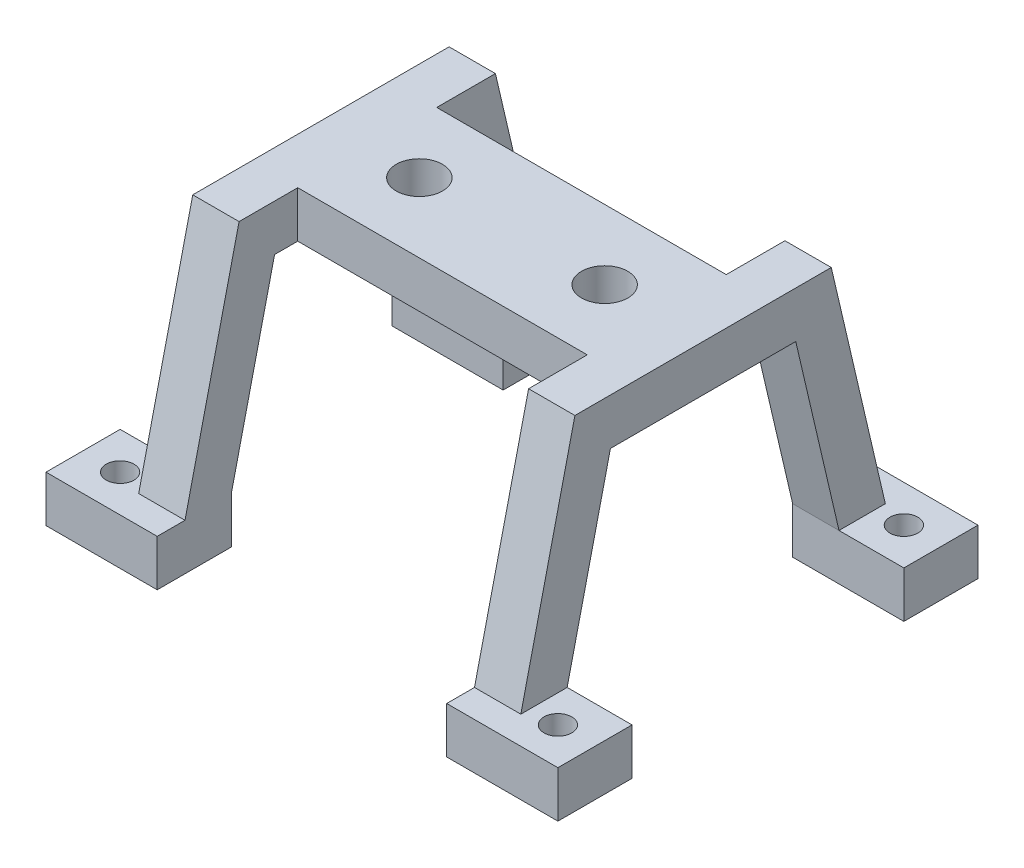
from build123d import *

# Parameters (mm, degrees)
SKETCH_1_W               = 12
SKETCH_1_H               = 8
SKETCH_1_R               = 1.5
EXTRUDE_1_DEPTH          = 5
EXTRUDE_2_DEPTH          = 5
SKETCH_3_W               = 15.622
SKETCH_3_H               = 15
SKETCH_3_R               = 2.5
EXTRUDE_3_DEPTH          = 5
MIRROR_5_COPY_1_SKETCH_W = 12
MIRROR_5_COPY_1_SKETCH_H = 8
MIRROR_5_COPY_1_SKETCH_R = 1.5
MIRROR_5_COPY_1_DEPTH    = 5
MIRROR_5_COPY_2_DEPTH    = 5


with BuildPart() as part:
    # 草图1 → 凸台-拉伸1 (new body)
    with BuildSketch(Plane(origin=(0, 0, 0), x_dir=(1, 0, 0), z_dir=(0, 1, 0))):
        with Locations((-21.622, -18.669)):
            Rectangle(SKETCH_1_W, SKETCH_1_H)
        with Locations(Location((-23.622, -18.669, 0), (0, 0, 270))):
            Circle(SKETCH_1_R, mode=Mode.SUBTRACT)
    extrude_1 = extrude(amount=EXTRUDE_1_DEPTH)

    # 草图2 → 凸台-拉伸2 (add)
    with BuildSketch(Plane(origin=(-15.622, 0, 0), x_dir=(0, 0, -1), z_dir=(1, 0, 0))):
        Polygon((-10, 25), (-14.669, 5), (-14.669, 0), (-19.669, 0), (-19.669, 5), (-13.83275, 30), (0, 30), (0, 25), align=None)
    extrude_2 = extrude(amount=-EXTRUDE_2_DEPTH)

    # 镜向4: 凸台-拉伸1, 凸台-拉伸2 across plane
    add(extrude_1.mirror(Plane.XY))
    add(extrude_2.mirror(Plane.XY))

    # 草图3 → 凸台-拉伸3 (add)
    with BuildSketch(Plane(origin=(0, 30, 0), x_dir=(1, 0, 0), z_dir=(0, 1, 0))):
        with Locations((-7.811, 0)):
            Rectangle(SKETCH_3_W, SKETCH_3_H)
        with Locations(Location((-10, 0, 0), (0, 0, 270))):
            Circle(SKETCH_3_R, mode=Mode.SUBTRACT)
    extrude_3 = extrude(amount=-EXTRUDE_3_DEPTH)

    # 镜向5: 凸台-拉伸1, 凸台-拉伸2, 凸台-拉伸3 across plane
    add(extrude_1.mirror(Plane(origin=(0, 0, 0), x_dir=(0, 0, 1), z_dir=(1, 0, 0))))
    add(extrude_2.mirror(Plane(origin=(0, 0, 0), x_dir=(0, 0, 1), z_dir=(1, 0, 0))))
    add(extrude_3.mirror(Plane(origin=(0, 0, 0), x_dir=(0, 0, 1), z_dir=(1, 0, 0))))



with BuildPart() as body_2:
    # 镜向5 copy 1 sketch → 镜向5 copy 1 (new body)
    with BuildSketch(Plane(origin=(0, 0, 0), x_dir=(-1, 0, 0), z_dir=(0, 1, 0))):
        with Locations((-21.622, -18.669)):
            Rectangle(MIRROR_5_COPY_1_SKETCH_W, MIRROR_5_COPY_1_SKETCH_H)
        with Locations(Location((-23.622, -18.669, 0), (0, 0, 270))):
            Circle(MIRROR_5_COPY_1_SKETCH_R, mode=Mode.SUBTRACT)
    extrude(amount=MIRROR_5_COPY_1_DEPTH)


with BuildPart() as part_1:
    add(part.part)

    add(body_2.part)  # 镜向5 copy 2 merges body 2
    # 镜向5 copy 2 sketch → 镜向5 copy 2 (add)
    with BuildSketch(Plane.ZY.offset(-15.622)):
        Polygon((-10, 25), (-14.669, 5), (-14.669, 0), (-19.669, 0), (-19.669, 5), (-13.83275, 30), (0, 30), (0, 25), align=None)
    extrude(amount=-MIRROR_5_COPY_2_DEPTH)


solid = part_1.part
